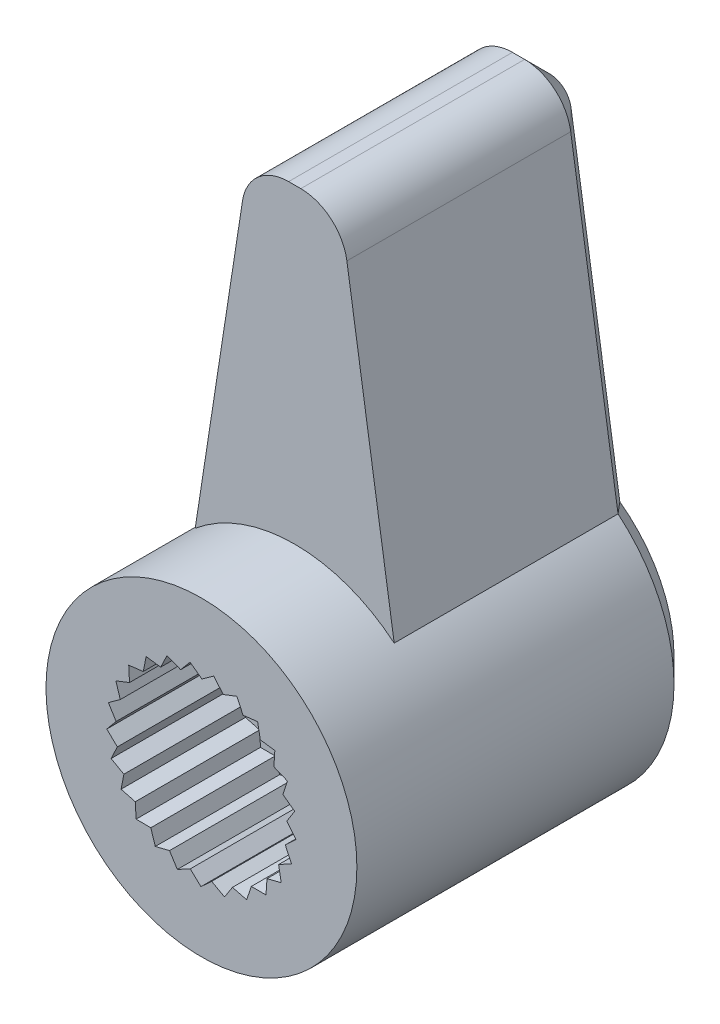
from build123d import *

# Parameters (mm, degrees)
SKETCH1_R           = 1.5
BOSS_EXTRUDE3_DEPTH = 8
SKETCH2_R           = 5
BOSS_EXTRUDE4_DEPTH = 3
CUT_EXTRUDE1_DEPTH  = 4
SKETCH5_R           = 2.4
CUT_EXTRUDE2_DEPTH  = 4
CHAMFER1_SIZE       = 0.8


with BuildPart() as part:
    # Sketch1 → Boss-Extrude3 (new body)
    with BuildSketch(Plane.XY):
        with BuildLine():
            Line((-3.2, 3.841874542), (-1.678558667, 13.728155368))
            ThreePointArc((-1.678558667, 13.728155368), (-1.172681412, 14.638471135), (-0.196011829, 15))
            Line((-0.196011829, 15), (0.196011829, 15))
            ThreePointArc((0.196011829, 15), (1.172681412, 14.638471135), (1.678558667, 13.728155368))
            Line((1.678558667, 13.728155368), (3.2, 3.841874542))
            ThreePointArc((3.2, 3.841874542), (0, -5), (-3.2, 3.841874542))
        make_face()
        Circle(SKETCH1_R, mode=Mode.SUBTRACT)
    extrude(amount=BOSS_EXTRUDE3_DEPTH)

    # Sketch2 → Boss-Extrude4 (add)
    with BuildSketch(Plane.XY.offset(8)):
        with Locations(Location((0, 0, 0), (0, 0, 129.7918195))):
            Circle(SKETCH2_R)
    extrude(amount=BOSS_EXTRUDE4_DEPTH)

    # Sketch4 → Cut-Extrude1 (cut)
    with BuildSketch(Plane.XY.offset(11)):
        Polygon((-2.992716352, 0.588344146), (-2.610587457, 0.864484315), (-2.752379426, 1.314118525), (-2.313582545, 1.48655165), (-2.339100377, 1.957322004), (-1.871206732, 2.015213479), (-1.778847049, 2.477539743), (-1.311256119, 2.417252033), (-1.106822219, 2.842084548), (-0.668914462, 2.667405751), (-0.365251678, 3.028050728), (0.015457551, 2.749956557), (0.399268969, 3.023753345), (0.69885831, 2.659717478), (1.138702078, 2.829462418), (1.33834723, 2.402358568), (1.806586348, 2.457385962), (1.893742872, 1.994050635), (2.360956154, 1.930902908), (2.330147685, 1.460449166), (2.766978401, 1.283094123), (2.620140749, 0.835082305), (2.999141219, 0.554663816), (2.745500733, 0.157244152), (3.042856964, -0.208618059), (2.698350809, -0.53047423), (2.895378816, -0.958791695), (2.48165358, -1.184860965), (2.565973368, -1.648720921), (2.10902493, -1.764798528), (2.075338376, -2.235054949), (1.603878487, -2.233847309), (1.454302241, -2.680952254), (0.99795446, -2.562535248), (0.741886949, -2.95839547), (0.329325284, -2.730209673), (-0.01714383, -3.049951818), (-0.359996611, -2.726334983), (-0.775097398, -2.949868476), (-1.026698595, -2.55115464), (-1.484348746, -2.664434049), (-1.62888933, -2.215675868), (-2.100333004, -2.211583431), (-2.128730958, -1.740978032), (-2.584345614, -1.619770893), (-2.494816591, -1.156888144), (-2.905974285, -0.926182193), (-2.704143722, -0.500106719), (-3.045009904, -0.174398059), (-2.743559558, 0.18809825), align=None)
    extrude(amount=-CUT_EXTRUDE1_DEPTH, mode=Mode.SUBTRACT)

    # Sketch5 → Cut-Extrude2 (cut)
    with BuildSketch(Plane(origin=(0, 0, 0), x_dir=(-1, 0, 0), z_dir=(0, 0, -1))):
        Circle(SKETCH5_R)
    extrude(amount=-CUT_EXTRUDE2_DEPTH, mode=Mode.SUBTRACT)

    # Chamfer1
    chamfer1_edges = [part.edges().sort_by_distance(p)[0] for p in [
        (2.4, 0, 0),
        (-2.439279334, 8.785014955, 0),
        (-1.172681412, 14.638471135, 0),
        (0, 15, 0),
        (1.172681412, 14.638471135, 0),
        (2.439279334, 8.785014955, 0),
        (0, -5, 0),
    ]]
    chamfer(chamfer1_edges, length=CHAMFER1_SIZE)


solid = part.part
